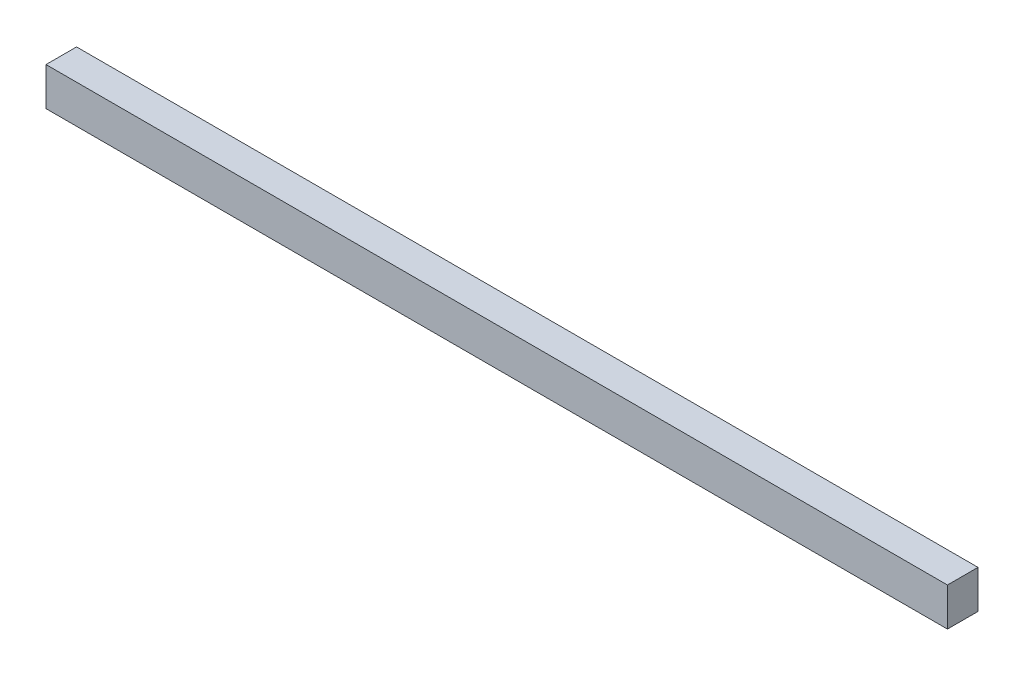
from build123d import *

# Parameters (mm, degrees)
FKAP_CERCEVE_UST_1_START = 20
SKETCH1_W                = 590
SKETCH1_H                = 25
FKAP_CERCEVE_UST_1_DEPTH = 20


with BuildPart() as part:
    # Sketch1 → FKAP_cerceve_ust_1 (new body)
    with BuildSketch(Plane.XY.offset(FKAP_CERCEVE_UST_1_START)):
        with Locations((320, 267.5)):
            Rectangle(SKETCH1_W, SKETCH1_H)
    extrude(amount=FKAP_CERCEVE_UST_1_DEPTH)


solid = part.part
